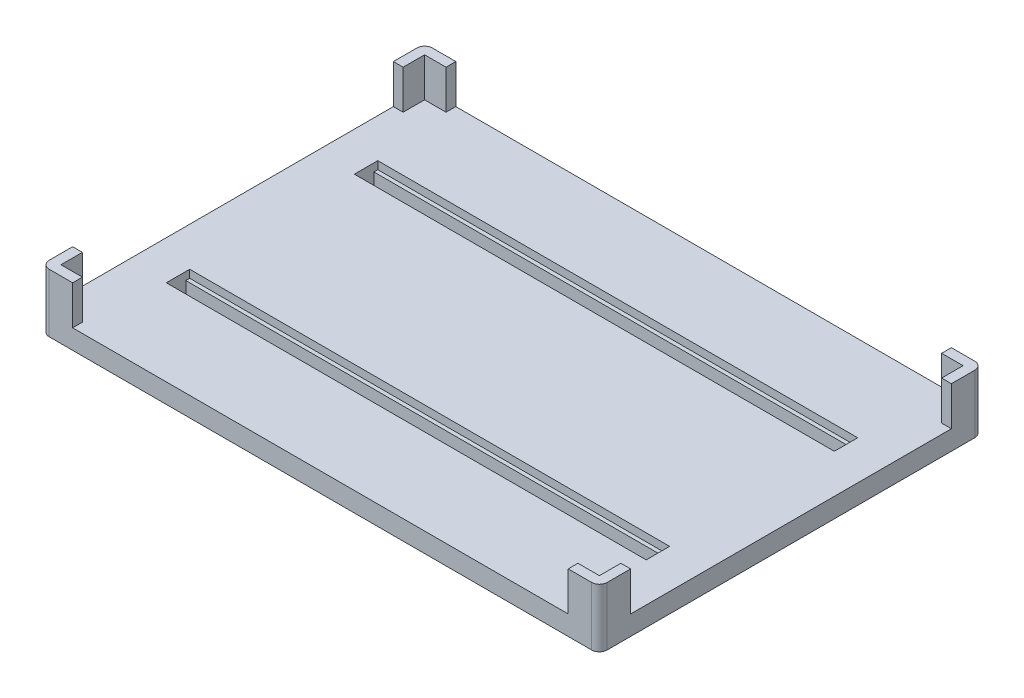
from build123d import *

# Parameters (mm, degrees)
BOSS_EXTRUDE1_DEPTH = 15
SKETCH2_W           = 138
SKETCH2_H           = 93.2
CUT_EXTRUDE1_DEPTH  = 10
SKETCH3_W           = 2.5
SKETCH3_H           = 82.2
SKETCH3_W_2         = 127
SKETCH3_H_2         = 2.5
CUT_EXTRUDE2_DEPTH  = 10
SKETCH7_W           = 123
SKETCH7_H           = 6
CUT_EXTRUDE6_DEPTH  = 2
SKETCH8_W           = 123
SKETCH8_H           = 4
CUT_EXTRUDE7_DEPTH  = 3


with BuildPart() as part:
    # Sketch1 → Boss-Extrude1 (new body)
    with BuildSketch(Plane(origin=(0, 0, 0), x_dir=(1, 0, 0), z_dir=(0, 1, 0))):
        with BuildLine():
            Line((-69.5, -49.1), (69.5, -49.1))
            ThreePointArc((69.5, -49.1), (70.914213562, -48.514213562), (71.5, -47.1))
            Line((71.5, -47.1), (71.5, 47.1))
            ThreePointArc((71.5, 47.1), (70.914213562, 48.514213562), (69.5, 49.1))
            Line((69.5, 49.1), (-69.5, 49.1))
            ThreePointArc((-69.5, 49.1), (-70.914213562, 48.514213562), (-71.5, 47.1))
            Line((-71.5, 47.1), (-71.5, -47.1))
            ThreePointArc((-71.5, -47.1), (-70.914213562, -48.514213562), (-69.5, -49.1))
        make_face()
    extrude(amount=BOSS_EXTRUDE1_DEPTH)

    # Sketch2 → Cut-Extrude1 (cut)
    with BuildSketch(Plane(origin=(0, 15, 0), x_dir=(1, 0, 0), z_dir=(0, 1, 0))):
        Rectangle(SKETCH2_W, SKETCH2_H)
    extrude(amount=-CUT_EXTRUDE1_DEPTH, mode=Mode.SUBTRACT)

    # Sketch3 → Cut-Extrude2 (cut)
    with BuildSketch(Plane(origin=(0, 15, 0), x_dir=(1, 0, 0), z_dir=(0, 1, 0))):
        with Locations((-70.25, 0)):
            Rectangle(SKETCH3_W, SKETCH3_H)
        with Locations((0, 47.85)):
            Rectangle(SKETCH3_W_2, SKETCH3_H_2)
        with Locations((70.25, 0)):
            Rectangle(SKETCH3_W, SKETCH3_H)
        with Locations((0, -47.85)):
            Rectangle(SKETCH3_W_2, SKETCH3_H_2)
    extrude(amount=-CUT_EXTRUDE2_DEPTH, mode=Mode.SUBTRACT)

    # Sketch7 → Cut-Extrude6 (cut)
    with BuildSketch(Plane(origin=(0, 5, 0), x_dir=(1, 0, 0), z_dir=(0, 1, 0))):
        with Locations((0, 24.1)):
            Rectangle(SKETCH7_W, SKETCH7_H)
        with Locations((0, -24.1)):
            Rectangle(SKETCH7_W, SKETCH7_H)
    extrude(amount=-CUT_EXTRUDE6_DEPTH, mode=Mode.SUBTRACT)

    # Sketch8 → Cut-Extrude7 (cut)
    with BuildSketch(Plane(origin=(0, 3, 0), x_dir=(1, 0, 0), z_dir=(0, 1, 0))):
        with Locations((0, 24.1)):
            Rectangle(SKETCH8_W, SKETCH8_H)
        with Locations((0, -24.1)):
            Rectangle(SKETCH8_W, SKETCH8_H)
    extrude(amount=-CUT_EXTRUDE7_DEPTH, mode=Mode.SUBTRACT)


solid = part.part
